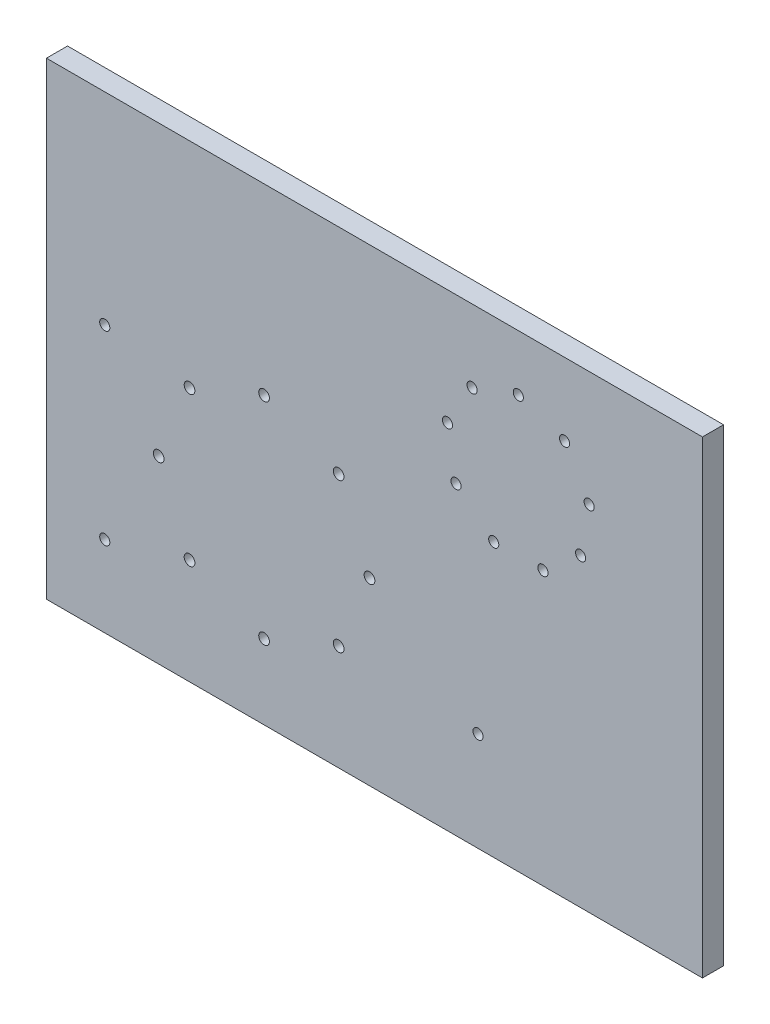
from build123d import *

# Parameters (mm, degrees)
SKETCH1_W                               = 355.6
SKETCH1_H                               = 254
BOSS_EXTRUDE1_DEPTH                     = 11.43
CBORE_FOR_M5_HEX_HEAD_BOLT1_D           = 5.8
CBORE_FOR_M5_HEX_HEAD_BOLT1_CBORE_D     = 12.24
CBORE_FOR_M5_HEX_HEAD_BOLT1_CBORE_DEPTH = 3.58
M5_CLEARANCE_HOLE1_D                    = 5.5


with BuildPart() as part:
    # Sketch1 → Boss-Extrude1 (new body)
    with BuildSketch(Plane.XY):
        with Locations((177.8, 127)):
            Rectangle(SKETCH1_W, SKETCH1_H)
    extrude(amount=BOSS_EXTRUDE1_DEPTH)

    # CBORE for M5 Hex Head Bolt1 (through all)
    with Locations(Plane(origin=(0, 0, 0), x_dir=(-1, 0, 0), z_dir=(0, 0, -1))):
        with Locations((-158.380154843, 138.036274419), (-117.969002298, 154.775121874), (-77.557849753, 138.036274419), (-60.819002298, 97.625121874), (-77.557849753, 57.213969329), (-117.969002298, 40.475121874), (-158.380154843, 57.213969329), (-175.119002298, 97.625121874)):
            CounterBoreHole(CBORE_FOR_M5_HEX_HEAD_BOLT1_D / 2, CBORE_FOR_M5_HEX_HEAD_BOLT1_CBORE_D / 2, CBORE_FOR_M5_HEX_HEAD_BOLT1_CBORE_DEPTH)

    # M5 Clearance Hole1 (through all)
    with Locations(Plane.XY.offset(11.43)):
        with Locations((31.609002298, 43.853644454), (31.609002298, 144.599742174), (233.918988076, 53.745357208), (255.781782298, 223.823644432), (280.850499062, 214.699377719), (294.189284644, 191.595923379), (289.556773026, 165.323644465), (269.12056788, 148.175632264), (242.442996716, 148.175632264), (222.006791569, 165.323644465), (217.374279952, 191.595923379), (230.713065534, 214.699377719)):
            Hole(M5_CLEARANCE_HOLE1_D / 2)


solid = part.part
